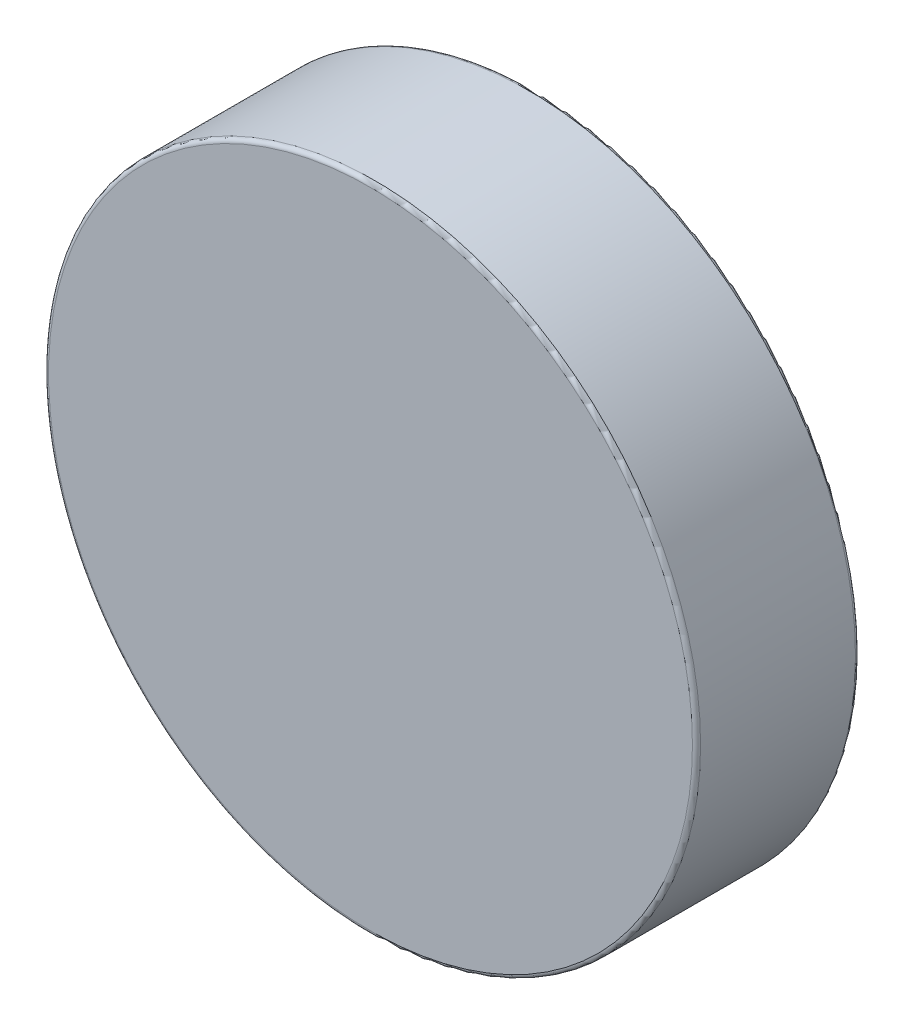
from build123d import *

# Parameters (mm, degrees)
BOSS_EXTRUDE1_DEPTH      = 0.79375
BOSS_EXTRUDE1_DEPTH_BACK = 0.79375
SKETCH3_R                = 3.175
FILLET1_R                = 0.0396875


with BuildPart() as part:
    # Sketch3 → Boss-Extrude1 (new, two sides: drawn at the far end of the back side and taken through both)
    with BuildSketch(Plane.XY.offset(-BOSS_EXTRUDE1_DEPTH_BACK)):
        Circle(SKETCH3_R)
    extrude(amount=BOSS_EXTRUDE1_DEPTH + BOSS_EXTRUDE1_DEPTH_BACK)

    # Fillet1
    fillet1_edges = [part.edges().sort_by_distance(p)[0] for p in [
        (-3.175, 0, -0.79375),
        (-3.175, 0, 0.79375),
    ]]
    fillet(fillet1_edges, radius=FILLET1_R)


solid = part.part
